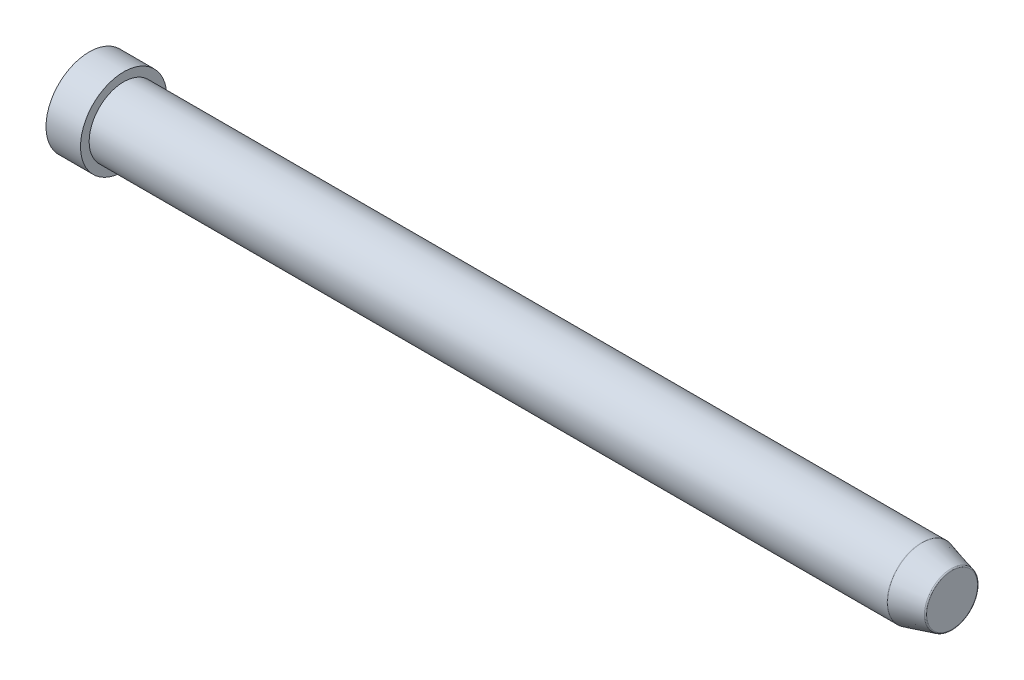
from build123d import *

# Parameters (mm, degrees)
CHAMFER1_SIZE  = 7
CHAMFER1_SIZE2 = 1.875644347
FILLET1_R      = 0.3


with BuildPart() as part:
    # Sketch1 → Revolve1 (revolve)
    with BuildSketch(Plane.XY, mode=Mode.PRIVATE) as revolve1_sk:
        Polygon((0, 0), (200, 0), (200, 8), (8, 8), (8, 10), (0, 10), align=None)
    revolve(revolve1_sk.sketch.rotate(Axis((0, 0, 0), (1, 0, 0)), 90), axis=Axis((0, 0, 0), (1, 0, 0)))

    # Chamfer1
    chamfer1_edges = [part.edges().sort_by_distance(p)[0] for p in [
        (200, 0, -8),
    ]]
    chamfer1_side = [part.faces().sort_by_distance(p)[0] for p in [
        (104, 0, -8),
    ]]
    chamfer(chamfer1_edges, length=CHAMFER1_SIZE, length2=CHAMFER1_SIZE2, reference=chamfer1_side[0])

    # Fillet1
    fillet1_edges = [part.edges().sort_by_distance(p)[0] for p in [
        (193, 0, -8),
        (200, 0, -6.124355653),
    ]]
    fillet(fillet1_edges, radius=FILLET1_R)


solid = part.part
